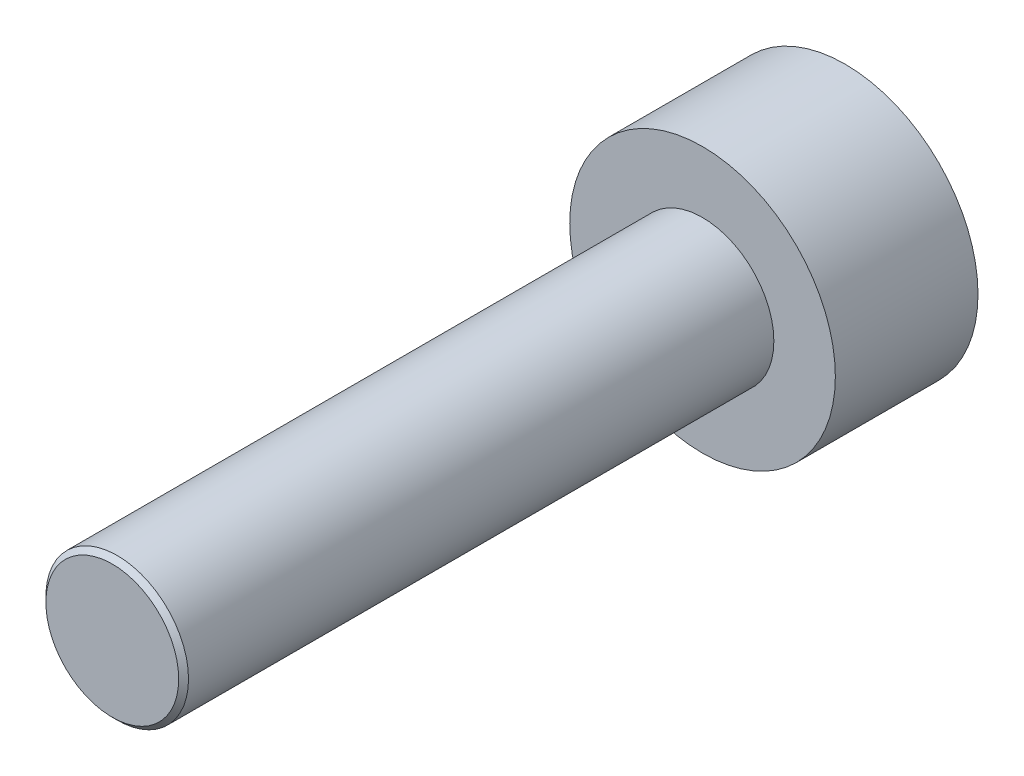
from build123d import *

# Parameters (mm, degrees)
SKIZZE1_R                       = 2.7
AUFSATZ_LINEAR_AUSTRAGEN2_DEPTH = 2.9
SKIZZE3_R                       = 1.45
AUFSATZ_LINEAR_AUSTRAGEN3_DEPTH = 12
FASE1_SIZE                      = 0.1


with BuildPart() as part:
    # Skizze1 → Aufsatz-Linear austragen2 (new body)
    with BuildSketch(Plane.XY):
        Circle(SKIZZE1_R)
    extrude(amount=AUFSATZ_LINEAR_AUSTRAGEN2_DEPTH)

    # Skizze3 → Aufsatz-Linear austragen3 (add)
    with BuildSketch(Plane.XY.offset(2.9)):
        Circle(SKIZZE3_R)
    extrude(amount=AUFSATZ_LINEAR_AUSTRAGEN3_DEPTH)

    # Fase1
    fase1_edges = [part.edges().sort_by_distance(p)[0] for p in [
        (-1.45, 0, 14.9),
    ]]
    chamfer(fase1_edges, length=FASE1_SIZE)


solid = part.part
